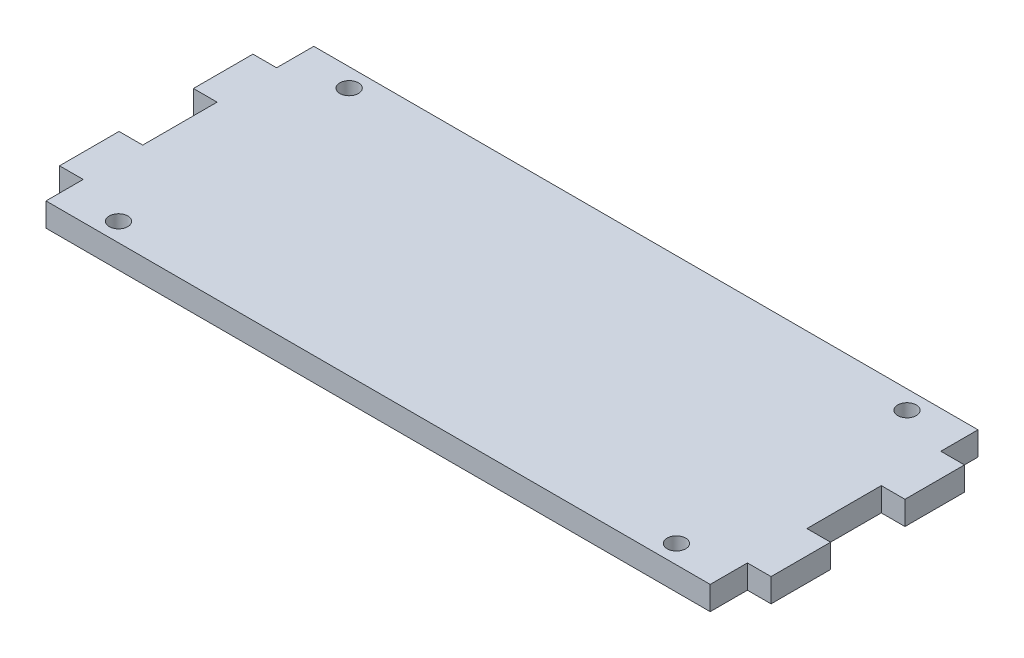
from build123d import *

# Parameters (mm, degrees)
SKETCH1_R           = 1.25
BOSS_EXTRUDE1_DEPTH = 3.18


with BuildPart() as part:
    # Sketch1 → Boss-Extrude1 (new body)
    with BuildSketch(Plane(origin=(0, 0, 0), x_dir=(1, 0, 0), z_dir=(0, 1, 0))):
        Polygon((-47.930848892, -13), (-44.750848892, -13), (-44.750848892, -18), (-40, -18), (-37.5, -18), (37.5, -18), (40, -18), (44.539151108, -18), (44.539151108, -13), (47.719151108, -13), (47.719151108, -5), (44.539151108, -5), (44.539151108, 5), (47.719151108, 5), (47.719151108, 13), (44.539151108, 13), (44.539151108, 18), (40, 18), (37.5, 18), (-37.5, 18), (-40, 18), (-44.750848892, 18), (-44.750848892, 13), (-47.930848892, 13), (-47.930848892, 5), (-44.750848892, 5), (-44.750848892, -5), (-47.930848892, -5), align=None)
        with Locations(Location((37.5, 15.5, 0), (0, 0, 90))):
            Circle(SKETCH1_R, mode=Mode.SUBTRACT)
        with Locations(Location((37.5, -15.5, 0), (0, 0, 90))):
            Circle(SKETCH1_R, mode=Mode.SUBTRACT)
        with Locations(Location((-37.5, -15.5, 0), (0, 0, 90))):
            Circle(SKETCH1_R, mode=Mode.SUBTRACT)
        with Locations(Location((-37.5, 15.5, 0), (0, 0, 90))):
            Circle(SKETCH1_R, mode=Mode.SUBTRACT)
    extrude(amount=BOSS_EXTRUDE1_DEPTH)


solid = part.part
